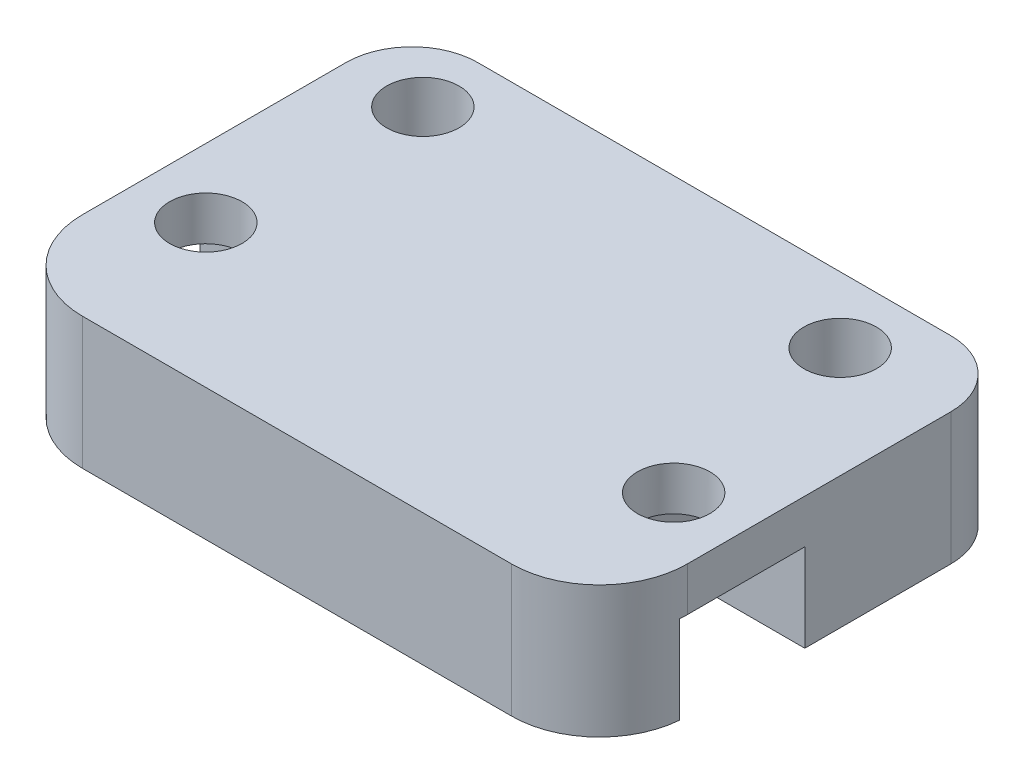
from build123d import *

# Parameters (mm, degrees)
SKETCH1_W               = 27.54
SKETCH1_H               = 6
BOSS_EXTRUDE1_DEPTH     = 13
SKETCH2_R               = 1.65
CUT_EXTRUDE1_DEPTH      = 20.86486597
SKETCH4_W               = 27.54
SKETCH4_H               = 6
BOSS_EXTRUDE2_DEPTH     = 6
FILLET1_R               = 4
FILLET2_R               = 3
CUT_EXTRUDE2_DEPTH      = 20.86486597
CUT_EXTRUDE2_DEPTH_BACK = 20.86486597
SKETCH3_R               = 1.65
CUT_EXTRUDE3_DEPTH      = 4


with BuildPart() as part:
    # Sketch1 → Boss-Extrude1 (new body)
    with BuildSketch(Plane.XY):
        Rectangle(SKETCH1_W, SKETCH1_H)
    extrude(amount=BOSS_EXTRUDE1_DEPTH)

    # Sketch2 → Cut-Extrude1 (cut, through all)
    with BuildSketch(Plane(origin=(0, 3, 0), x_dir=(1, 0, 0), z_dir=(0, 1, 0))):
        with Locations(Location((-10.65, -6.5, 0), (0, 0, 270))):
            Circle(SKETCH2_R)
        with Locations(Location((10.65, -6.5, 0), (0, 0, 270))):
            Circle(SKETCH2_R)
    extrude(amount=-CUT_EXTRUDE1_DEPTH, mode=Mode.SUBTRACT)

    # Sketch4 → Boss-Extrude2 (add)
    with BuildSketch(Plane(origin=(0, 0, 0), x_dir=(-1, 0, 0), z_dir=(0, 0, -1))):
        Rectangle(SKETCH4_W, SKETCH4_H)
    extrude(amount=BOSS_EXTRUDE2_DEPTH)

    # Fillet1
    fillet1_edges = [part.edges().sort_by_distance(p)[0] for p in [
        (-13.77, 0, 13),
        (13.77, 0, 13),
    ]]
    fillet(fillet1_edges, radius=FILLET1_R)

    # Fillet2
    fillet2_edges = [part.edges().sort_by_distance(p)[0] for p in [
        (13.77, 0, -6),
        (-13.77, 0, -6),
    ]]
    fillet(fillet2_edges, radius=FILLET2_R)

    # Sketch3 → Cut-Extrude2 (cut, two sides: drawn at the far end of the back side and taken through both)
    with BuildSketch(Plane.XZ.offset(3).offset(-CUT_EXTRUDE2_DEPTH_BACK)):
        with Locations(Location((8.73, -3, 0), (0, 0, 270))):
            Circle(SKETCH3_R)
        with Locations(Location((-10.27, -3, 0), (0, 0, 270))):
            Circle(SKETCH3_R)
    extrude(amount=CUT_EXTRUDE2_DEPTH + CUT_EXTRUDE2_DEPTH_BACK, mode=Mode.SUBTRACT)

    # Sketch6 → Cut-Extrude3 (cut)
    with BuildSketch(Plane.XZ.offset(3)):
        Polygon((12.295448267, 9.35), (15.295448267, 9.35), (15.295448267, 3.65), (12.295448267, 3.65), (9.004551733, 3.65), (7.359103466, 6.5), (9.004551733, 9.35), align=None)
        Polygon((-12.295448267, 3.65), (-9.004551733, 3.65), (-7.359103466, 6.5), (-9.004551733, 9.35), (-12.295448267, 9.35), (-15.295448267, 9.35), (-15.295448267, 3.65), align=None)
    extrude(amount=-CUT_EXTRUDE3_DEPTH, mode=Mode.SUBTRACT)


solid = part.part
